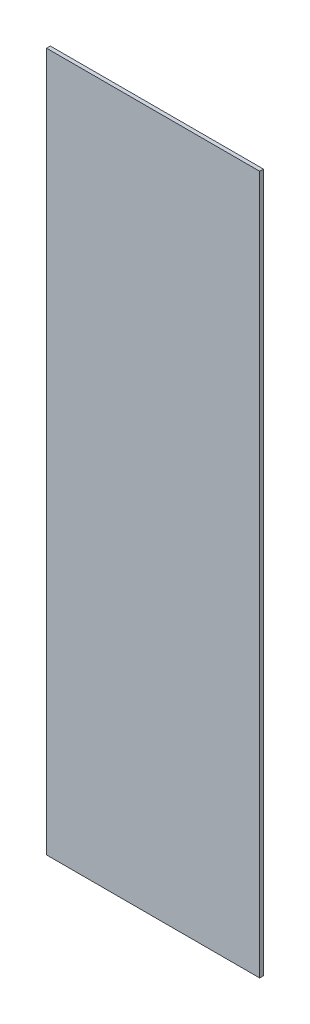
from build123d import *

# Parameters (mm, degrees)
SKETCH1_W           = 169
SKETCH1_H           = 554
BOSS_EXTRUDE1_DEPTH = 3


with BuildPart() as part:
    # Sketch1 → Boss-Extrude1 (new body)
    with BuildSketch(Plane.XY):
        Rectangle(SKETCH1_W, SKETCH1_H)
    extrude(amount=BOSS_EXTRUDE1_DEPTH)


solid = part.part
